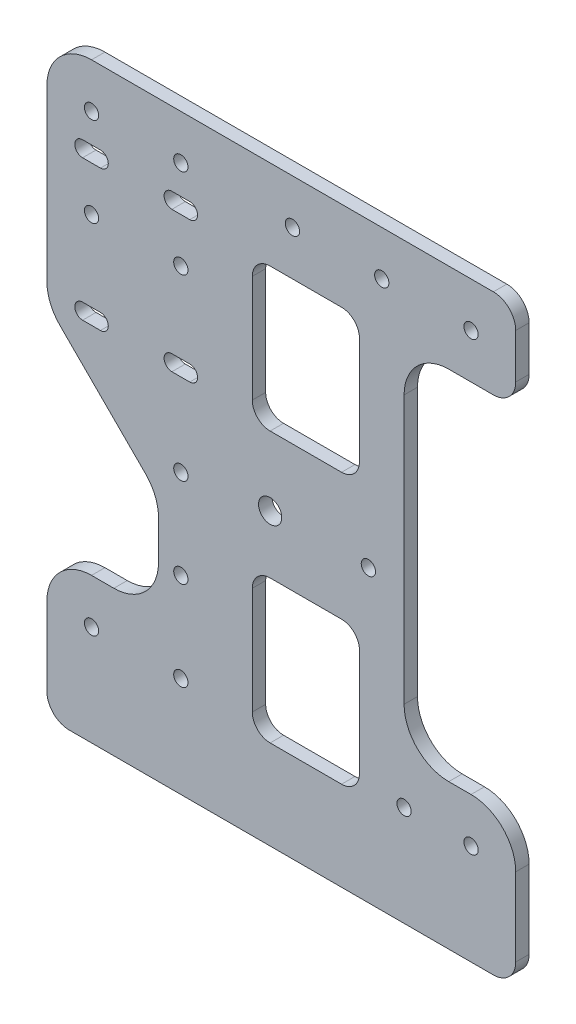
from build123d import *

# Parameters (mm, degrees)
SKETCH_1_R      = 1.6
SKETCH_1_R_2    = 2.6
EXTRUDE_1_DEPTH = 1.5


with BuildPart() as part:
    # 草图1 → 凸台-拉伸1 (new, symmetric)
    with BuildSketch(Plane.XY):
        with BuildLine():
            Line((60, 77.5), (-30, 77.5))
            ThreePointArc((-30, 77.5), (-37.071067812, 74.571067812), (-40, 67.5))
            Line((-40, 67.5), (-40, 29.5))
            ThreePointArc((-40, 29.5), (-39.238795325, 25.673165676), (-37.071067812, 22.428932188))
            Line((-37.071067812, 22.428932188), (-17.928932188, 3.286796564))
            ThreePointArc((-17.928932188, 3.286796564), (-15.761204675, 0.042563076), (-15, -3.784271247))
            Line((-15, -3.784271247), (-15, -12.5))
            ThreePointArc((-15, -12.5), (-17.928932188, -19.571067812), (-25, -22.5))
            Line((-25, -22.5), (-30, -22.5))
            ThreePointArc((-30, -22.5), (-37.071067812, -25.428932188), (-40, -32.5))
            Line((-40, -32.5), (-40, -50))
            ThreePointArc((-40, -50), (-38.535533906, -53.535533906), (-35, -55))
            Line((-35, -55), (60, -55))
            ThreePointArc((60, -55), (63.535533906, -53.535533906), (65, -50))
            Line((65, -50), (65, -32.5))
            ThreePointArc((65, -32.5), (62.071067812, -25.428932188), (55, -22.5))
            Line((55, -22.5), (50, -22.5))
            ThreePointArc((50, -22.5), (42.928932188, -19.571067812), (40, -12.5))
            Line((40, -12.5), (40, 47.5))
            ThreePointArc((40, 47.5), (42.928932188, 54.571067812), (50, 57.5))
            Line((50, 57.5), (60, 57.5))
            ThreePointArc((60, 57.5), (63.535533906, 58.964466094), (65, 62.5))
            Line((65, 62.5), (65, 72.5))
            ThreePointArc((65, 72.5), (63.535533906, 76.035533906), (60, 77.5))
        make_face()
        with Locations((-30, 67.5)):
            Circle(SKETCH_1_R, mode=Mode.SUBTRACT)
        with Locations((-10, 67.5)):
            Circle(SKETCH_1_R, mode=Mode.SUBTRACT)
        with Locations((-10, -32.5)):
            Circle(SKETCH_1_R, mode=Mode.SUBTRACT)
        with Locations((-30, -32.5)):
            Circle(SKETCH_1_R, mode=Mode.SUBTRACT)
        with Locations((10, 10)):
            Circle(SKETCH_1_R_2, mode=Mode.SUBTRACT)
        with Locations((15, 67.5)):
            Circle(SKETCH_1_R, mode=Mode.SUBTRACT)
        with Locations((55, 67.5)):
            Circle(SKETCH_1_R, mode=Mode.SUBTRACT)
        with Locations((32, 10)):
            Circle(SKETCH_1_R, mode=Mode.SUBTRACT)
        with Locations((35, 67.5)):
            Circle(SKETCH_1_R, mode=Mode.SUBTRACT)
        with Locations((40, -32.5)):
            Circle(SKETCH_1_R, mode=Mode.SUBTRACT)
        with Locations((55, -32.5)):
            Circle(SKETCH_1_R, mode=Mode.SUBTRACT)
        with Locations((-10, -12.5)):
            Circle(SKETCH_1_R, mode=Mode.SUBTRACT)
        with Locations((-10, 7.5)):
            Circle(SKETCH_1_R, mode=Mode.SUBTRACT)
        with Locations((-10, 47.5)):
            Circle(SKETCH_1_R, mode=Mode.SUBTRACT)
        with Locations((-30, 47.5)):
            Circle(SKETCH_1_R, mode=Mode.SUBTRACT)
        with BuildLine():
            Line((-32, 29.5), (-28, 29.5))
            ThreePointArc((-28, 29.5), (-26.25, 27.75), (-28, 26))
            Line((-28, 26), (-32, 26))
            ThreePointArc((-32, 26), (-33.75, 27.75), (-32, 29.5))
        make_face(mode=Mode.SUBTRACT)
        with BuildLine():
            Line((-12, 29.5), (-8, 29.5))
            ThreePointArc((-8, 29.5), (-6.25, 27.75), (-8, 26))
            Line((-8, 26), (-12, 26))
            ThreePointArc((-12, 26), (-13.75, 27.75), (-12, 29.5))
        make_face(mode=Mode.SUBTRACT)
        with BuildLine():
            Line((-12, 61), (-8, 61))
            ThreePointArc((-8, 61), (-6.25, 59.25), (-8, 57.5))
            Line((-8, 57.5), (-12, 57.5))
            ThreePointArc((-12, 57.5), (-13.75, 59.25), (-12, 61))
        make_face(mode=Mode.SUBTRACT)
        with BuildLine():
            Line((-32, 61), (-28, 61))
            ThreePointArc((-28, 61), (-26.25, 59.25), (-28, 57.5))
            Line((-28, 57.5), (-32, 57.5))
            ThreePointArc((-32, 57.5), (-33.75, 59.25), (-32, 61))
        make_face(mode=Mode.SUBTRACT)
        with BuildLine():
            Line((6, -7), (6, -31))
            ThreePointArc((6, -31), (7.171572875, -33.828427125), (10, -35))
            Line((10, -35), (26, -35))
            ThreePointArc((26, -35), (28.828427125, -33.828427125), (30, -31))
            Line((30, -31), (30, -7))
            ThreePointArc((30, -7), (28.828427125, -4.171572875), (26, -3))
            Line((26, -3), (10, -3))
            ThreePointArc((10, -3), (7.171572875, -4.171572875), (6, -7))
        make_face(mode=Mode.SUBTRACT)
        with BuildLine():
            Line((10, 57.5), (26, 57.5))
            ThreePointArc((26, 57.5), (28.828427125, 56.328427125), (30, 53.5))
            Line((30, 53.5), (30, 29.5))
            ThreePointArc((30, 29.5), (28.828427125, 26.671572875), (26, 25.5))
            Line((26, 25.5), (10, 25.5))
            ThreePointArc((10, 25.5), (7.171572875, 26.671572875), (6, 29.5))
            Line((6, 29.5), (6, 53.5))
            ThreePointArc((6, 53.5), (7.171572875, 56.328427125), (10, 57.5))
        make_face(mode=Mode.SUBTRACT)
    extrude(amount=EXTRUDE_1_DEPTH, both=True)


solid = part.part
